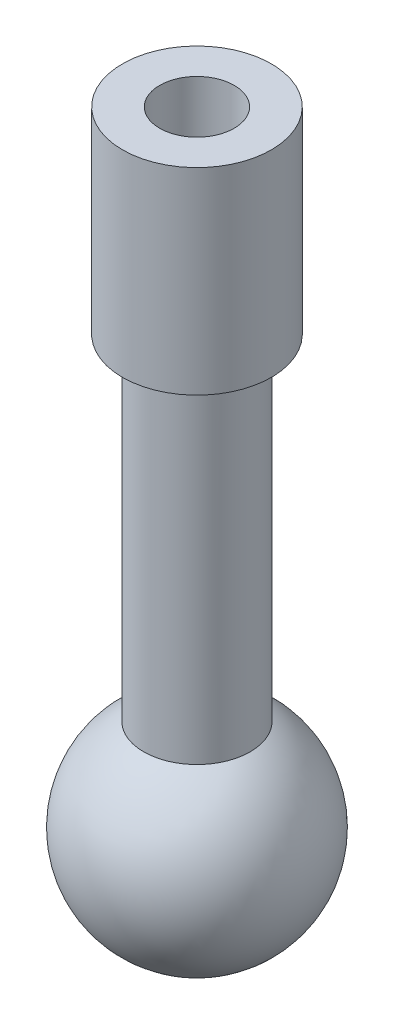
from build123d import *

# Parameters (mm, degrees)
SKETCH3_W          = 7
SKETCH3_H          = 18.520312213
SKETCH4_R          = 3.5
CUT_EXTRUDE1_DEPTH = 5


with BuildPart() as part:
    # Sketch1 → Revolve1 (revolve)
    with BuildSketch(Plane.XY, mode=Mode.PRIVATE) as revolve1_sk:
        with BuildLine():
            Line((0, 41.73429327), (5, 41.73429327))
            Line((5, 41.73429327), (5, -8.26570673))
            ThreePointArc((5, -8.26570673), (9.659258263, -19.514151219), (0, -26.925960768))
            Line((0, -26.925960768), (0, 41.73429327))
        make_face()
    revolve(revolve1_sk.sketch.rotate(Axis((0, 41.73429327, 0), (0, -1, 0)), 180), axis=Axis((0, 41.73429327, 0), (0, -1, 0)))

    # Sketch3 → Revolve3 (revolve)
    with BuildSketch(Plane.XY, mode=Mode.PRIVATE) as revolve3_sk:
        with Locations((3.5, 32.474137164)):
            Rectangle(SKETCH3_W, SKETCH3_H)
    revolve(revolve3_sk.sketch.rotate(Axis((0, 41.73429327, 0), (0, -1, 0)), 90), axis=Axis((0, 41.73429327, 0), (0, -1, 0)))

    # Sketch4 → Cut-Extrude1 (cut)
    with BuildSketch(Plane(origin=(0, 41.73429327, 0), x_dir=(1, 0, 0), z_dir=(0, 1, 0))):
        with Locations(Location((0, 0, 0), (0, 0, 180))):
            Circle(SKETCH4_R)
    extrude(amount=-CUT_EXTRUDE1_DEPTH, mode=Mode.SUBTRACT)


solid = part.part
